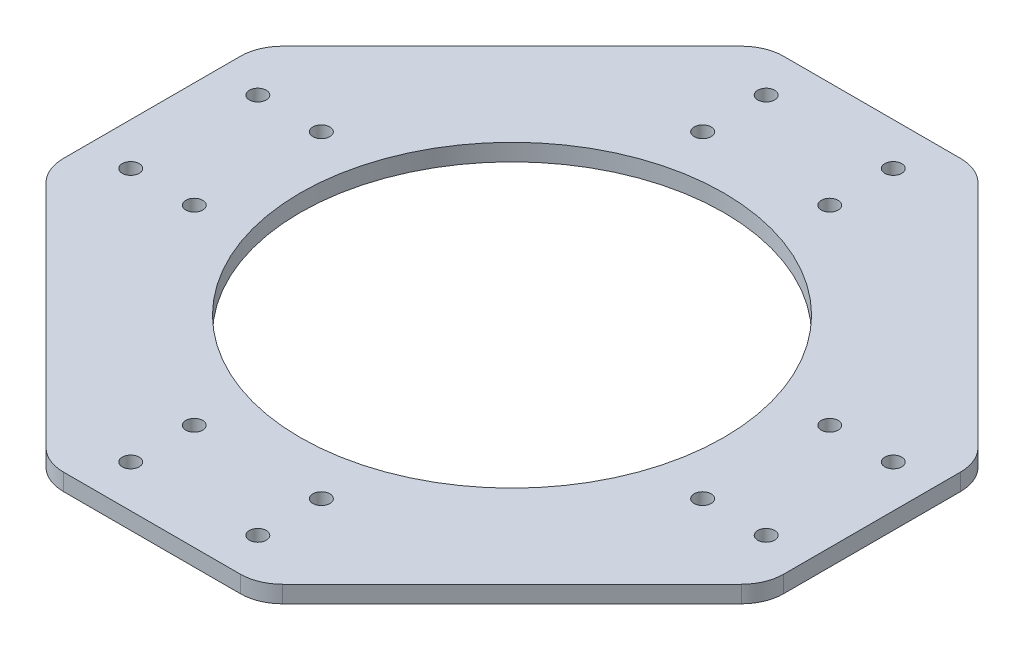
from build123d import *

# Parameters (mm, degrees)
SKETCH_1_R      = 2
SKETCH_1_R_2    = 50
EXTRUDE_1_DEPTH = 4
FILLET_1_R      = 10


with BuildPart() as part:
    # 草图1 → 凸台-拉伸1 (new body)
    with BuildSketch(Plane(origin=(0, 0, 0), x_dir=(1, 0, 0), z_dir=(0, 1, 0))):
        Polygon((25, 85), (-25, 85), (-85, 25), (-85, -25), (-25, -85), (25, -85), (85, -25), (85, 25), align=None)
        with Locations(Location((-15, -75, 0), (0, 0, 270))):
            Circle(SKETCH_1_R, mode=Mode.SUBTRACT)
        with Locations(Location((-15, -60, 0), (0, 0, 270))):
            Circle(SKETCH_1_R, mode=Mode.SUBTRACT)
        with Locations(Location((-75, -15, 0), (0, 0, 270))):
            Circle(SKETCH_1_R, mode=Mode.SUBTRACT)
        with Locations(Location((-60, -15, 0), (0, 0, 270))):
            Circle(SKETCH_1_R, mode=Mode.SUBTRACT)
        with Locations(Location((15, -75, 0), (0, 0, 270))):
            Circle(SKETCH_1_R, mode=Mode.SUBTRACT)
        with Locations(Location((15, -60, 0), (0, 0, 270))):
            Circle(SKETCH_1_R, mode=Mode.SUBTRACT)
        with Locations(Location((0, 0, 0), (0, 0, 270))):
            Circle(SKETCH_1_R_2, mode=Mode.SUBTRACT)
        with Locations(Location((60, -15, 0), (0, 0, 270))):
            Circle(SKETCH_1_R, mode=Mode.SUBTRACT)
        with Locations(Location((75, -15, 0), (0, 0, 270))):
            Circle(SKETCH_1_R, mode=Mode.SUBTRACT)
        with Locations(Location((-75, 15, 0), (0, 0, 270))):
            Circle(SKETCH_1_R, mode=Mode.SUBTRACT)
        with Locations(Location((-60, 15, 0), (0, 0, 270))):
            Circle(SKETCH_1_R, mode=Mode.SUBTRACT)
        with Locations(Location((-15, 60, 0), (0, 0, 270))):
            Circle(SKETCH_1_R, mode=Mode.SUBTRACT)
        with Locations(Location((-15, 75, 0), (0, 0, 270))):
            Circle(SKETCH_1_R, mode=Mode.SUBTRACT)
        with Locations(Location((60, 15, 0), (0, 0, 270))):
            Circle(SKETCH_1_R, mode=Mode.SUBTRACT)
        with Locations(Location((75, 15, 0), (0, 0, 270))):
            Circle(SKETCH_1_R, mode=Mode.SUBTRACT)
        with Locations(Location((15, 60, 0), (0, 0, 270))):
            Circle(SKETCH_1_R, mode=Mode.SUBTRACT)
        with Locations(Location((15, 75, 0), (0, 0, 270))):
            Circle(SKETCH_1_R, mode=Mode.SUBTRACT)
    extrude(amount=EXTRUDE_1_DEPTH)

    # 圆角1
    fillet_1_edges = [part.edges().sort_by_distance(p)[0] for p in [
        (-25, 2, 85),
        (-85, 2, 25),
        (-85, 2, -25),
        (-25, 2, -85),
        (25, 2, -85),
        (85, 2, -25),
        (85, 2, 25),
        (25, 2, 85),
    ]]
    fillet(fillet_1_edges, radius=FILLET_1_R)


solid = part.part
